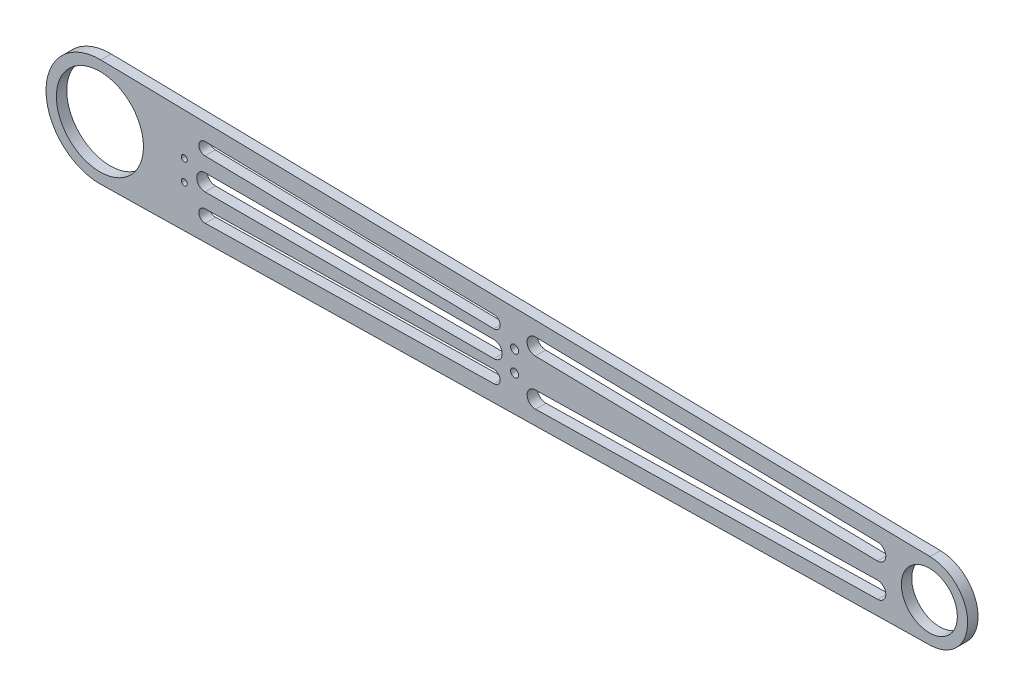
from build123d import *

# Parameters (mm, degrees)
SKETCH_1_R          = 21
SKETCH_1_R_2        = 13.5
EXTRUDE_1_DEPTH     = 5
SKETCH_4_R          = 1.45
CUT_EXTRUDE_1_DEPTH = 420.336678577
SKETCH_5_R          = 1.95
CUT_EXTRUDE_2_DEPTH = 420.336678577
CUT_EXTRUDE_3_DEPTH = 420.336678577


with BuildPart() as part:
    # 草图1 → 凸台-拉伸1 (new body)
    with BuildSketch(Plane.XY):
        with BuildLine():
            Line((400.346875, 18.496747761), (0.4875, 25.995429286))
            ThreePointArc((0.4875, 25.995429286), (-26, 0), (0.4875, -25.995429286))
            Line((0.4875, -25.995429286), (400.346875, -18.496747761))
            ThreePointArc((400.346875, -18.496747761), (418.5, 0), (400.346875, 18.496747761))
        make_face()
        Circle(SKETCH_1_R, mode=Mode.SUBTRACT)
        with Locations((400, 0)):
            Circle(SKETCH_1_R_2, mode=Mode.SUBTRACT)
    extrude(amount=EXTRUDE_1_DEPTH)

    # 草图4 → 切除-拉伸1 (cut, through all)
    with BuildSketch(Plane(origin=(0, 0, 0), x_dir=(-1, 0, 0), z_dir=(0, 0, -1))):
        with Locations((-40.693979899, -5)):
            Circle(SKETCH_4_R)
        with Locations(Location((-40.693979899, 5, 0), (0, 0, 180))):
            Circle(SKETCH_4_R)
    extrude(amount=-CUT_EXTRUDE_1_DEPTH, mode=Mode.SUBTRACT)

    # 草图5 → 切除-拉伸2 (cut, through all)
    with BuildSketch(Plane(origin=(0, 0, 0), x_dir=(-1, 0, 0), z_dir=(0, 0, -1))):
        with Locations((-200, 5)):
            Circle(SKETCH_5_R)
        with Locations(Location((-200, -5, 0), (0, 0, 180))):
            Circle(SKETCH_5_R)
    extrude(amount=-CUT_EXTRUDE_2_DEPTH, mode=Mode.SUBTRACT)

    # 草图6 → 切除-拉伸3 (cut, through all)
    with BuildSketch(Plane.XY.offset(5)):
        with BuildLine():
            Line((50.750229899, 17.051430775), (190.05625, 14.438983638))
            ThreePointArc((190.05625, 14.438983638), (192.99947261, 11.383261028), (189.94375, 8.440038418))
            Line((189.94375, 8.440038418), (50.637729899, 11.052485555))
            ThreePointArc((50.637729899, 11.052485555), (47.694507289, 14.108208165), (50.750229899, 17.051430775))
        make_face()
        with BuildLine():
            Line((210.075, 15.063741906), (375.075, 11.969447939))
            ThreePointArc((375.075, 11.969447939), (378.999296813, 7.895151126), (374.925, 3.970854313))
            Line((374.925, 3.970854313), (209.925, 7.06514828))
            ThreePointArc((209.925, 7.06514828), (206.000703187, 11.139445093), (210.075, 15.063741906))
        make_face()
        with BuildLine():
            Line((210.075, -15.063741906), (375.075, -11.969447939))
            ThreePointArc((375.075, -11.969447939), (378.999296813, -7.895151126), (374.925, -3.970854313))
            Line((374.925, -3.970854313), (209.925, -7.06514828))
            ThreePointArc((209.925, -7.06514828), (206.000703187, -11.139445093), (210.075, -15.063741906))
        make_face()
        with BuildLine():
            Line((50.750229899, -17.051430775), (190.05625, -14.438983638))
            ThreePointArc((190.05625, -14.438983638), (192.99947261, -11.383261028), (189.94375, -8.440038418))
            Line((189.94375, -8.440038418), (50.637729899, -11.052485555))
            ThreePointArc((50.637729899, -11.052485555), (47.694507289, -14.108208165), (50.750229899, -17.051430775))
        make_face()
        with BuildLine():
            Line((50.693979899, 4), (190, 4))
            ThreePointArc((190, 4), (194, 0), (190, -4))
            Line((190, -4), (50.693979899, -4))
            ThreePointArc((50.693979899, -4), (46.693979899, 0), (50.693979899, 4))
        make_face()
    extrude(amount=-CUT_EXTRUDE_3_DEPTH, mode=Mode.SUBTRACT)


solid = part.part
